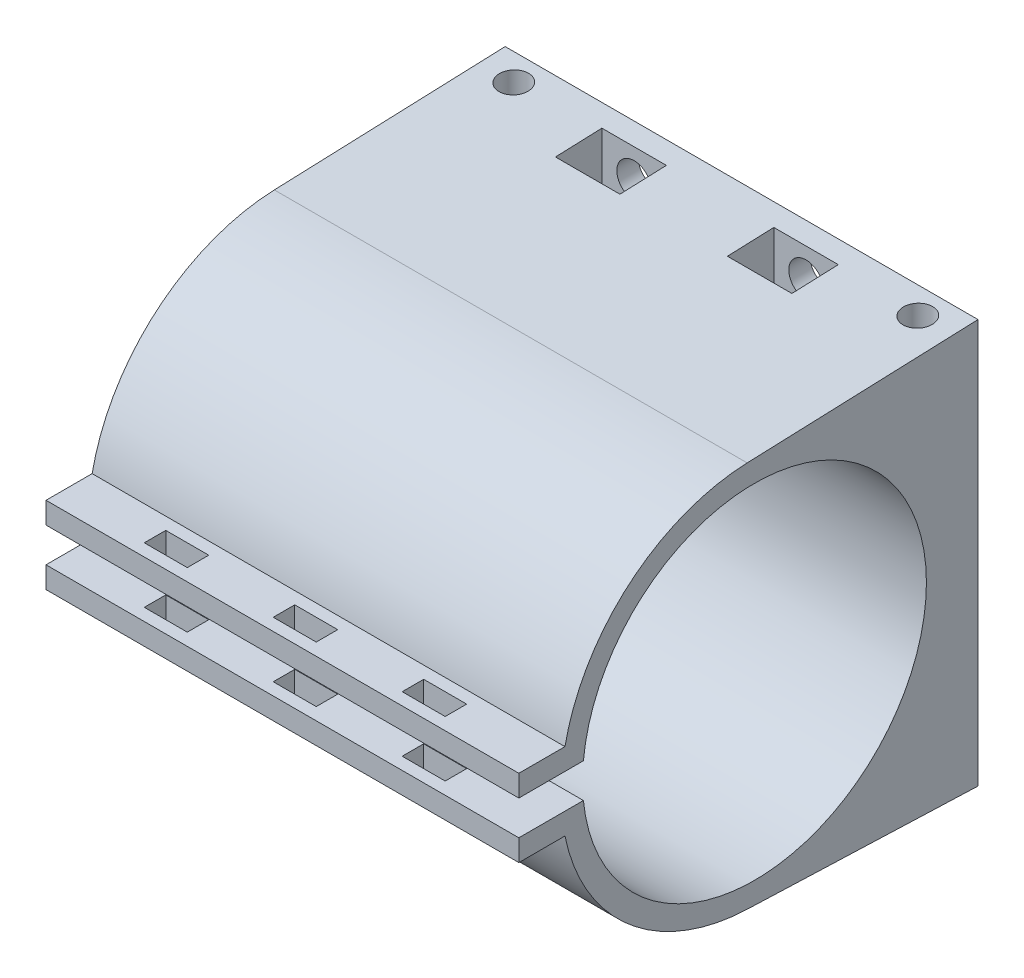
from build123d import *

# Parameters (mm, degrees)
SKETCH1_R               = 28.575
SKETCH1_R_2             = 25.4
BOSS_EXTRUDE1_DEPTH     = 69.85
BOSS_EXTRUDE2_DEPTH     = 69.85
SKETCH4_R               = 2.5527
CUT_EXTRUDE1_DEPTH      = 16.256
CUT_EXTRUDE2_DEPTH      = 6.858
SKETCH9_W               = 9.949702626
SKETCH9_H               = 5.08
CUT_EXTRUDE3_DEPTH      = 83.825520976
BOSS_EXTRUDE3_DEPTH     = 69.85
SKETCH11_W              = 6.35
SKETCH11_H              = 3.175
CUT_EXTRUDE4_DEPTH      = 86.763649601
CUT_EXTRUDE5_DEPTH      = 84.332323558
CUT_EXTRUDE5_DEPTH_BACK = 84.332323558
SKETCH13_R              = 2.1844


with BuildPart() as part:
    # Sketch1 → Boss-Extrude1 (new body)
    with BuildSketch(Plane(origin=(0, 0, 0), x_dir=(0, 0, -1), z_dir=(1, 0, 0))):
        Circle(SKETCH1_R)
        Circle(SKETCH1_R_2, mode=Mode.SUBTRACT)
    extrude(amount=BOSS_EXTRUDE1_DEPTH)

    # Sketch2 → Boss-Extrude2 (add, through all)
    with BuildSketch(Plane(origin=(69.85, 0, 0), x_dir=(0, 0, -1), z_dir=(1, 0, 0))):
        with BuildLine():
            Line((33.02, -29.845), (33.02, 29.845))
            Line((33.02, 29.845), (-1.080565529, 28.554561862))
            ThreePointArc((-1.080565529, 28.554561862), (28.575, 0), (-1.080565529, -28.554561862))
            Line((-1.080565529, -28.554561862), (33.02, -29.845))
        make_face()
    extrude(amount=-BOSS_EXTRUDE2_DEPTH)

    # Sketch4 → Cut-Extrude1 (cut)
    with BuildSketch(Plane(origin=(0, 0, -33.02), x_dir=(-1, 0, 0), z_dir=(0, 0, -1))):
        with Locations((-47.625, 25.4)):
            Circle(SKETCH4_R)
        with Locations((-22.225, 25.4)):
            Circle(SKETCH4_R)
        with Locations((-34.925, -25.4)):
            Circle(SKETCH4_R)
    extrude(amount=-CUT_EXTRUDE1_DEPTH, mode=Mode.SUBTRACT)

    # Sketch7 → Cut-Extrude2 (cut)
    with BuildSketch(Plane(origin=(0, 0, -29.845), x_dir=(-1, 0, 0), z_dir=(0, 0, -1))):
        Polygon((-47.625, 19.900738686), (-42.8625, 22.650369343), (-42.8625, 29.845), (-45.79896584, 29.845), (-49.45103416, 29.845), (-52.3875, 29.845), (-52.3875, 22.650369343), align=None)
        Polygon((-24.05103416, 29.845), (-26.9875, 29.845), (-26.9875, 22.650369343), (-22.225, 19.900738686), (-17.4625, 22.650369343), (-17.4625, 29.845), (-20.39896584, 29.845), align=None)
        Polygon((-39.6875, -22.650369343), (-39.6875, -29.845), (-36.75103416, -29.845), (-33.09896584, -29.845), (-30.1625, -29.845), (-30.1625, -22.650369343), (-34.925, -19.900738686), align=None)
    extrude(amount=-CUT_EXTRUDE2_DEPTH, mode=Mode.SUBTRACT)

    # Sketch9 → Cut-Extrude3 (cut, through all)
    with BuildSketch(Plane(origin=(69.85, 0, 0), x_dir=(0, 0, -1), z_dir=(1, 0, 0))):
        with Locations((-25.4, 0)):
            Rectangle(SKETCH9_W, SKETCH9_H)
    extrude(amount=-CUT_EXTRUDE3_DEPTH, mode=Mode.SUBTRACT)

    # Sketch10 → Boss-Extrude3 (add, through all)
    with BuildSketch(Plane(origin=(69.85, 0, 0), x_dir=(0, 0, -1), z_dir=(1, 0, 0))):
        with BuildLine():
            Line((-34.811887235, 2.54), (-28.461887235, 2.54))
            ThreePointArc((-28.461887235, 2.54), (-28.274378752, 4.134021188), (-27.99766776, 5.715))
            Line((-27.99766776, 5.715), (-34.811887235, 5.715))
            Line((-34.811887235, 5.715), (-34.811887235, 2.54))
        make_face()
        with BuildLine():
            ThreePointArc((-27.99766776, -5.715), (-28.274378752, -4.134021188), (-28.461887235, -2.54))
            Line((-28.461887235, -2.54), (-34.811887235, -2.54))
            Line((-34.811887235, -2.54), (-34.811887235, -5.715))
            Line((-34.811887235, -5.715), (-27.99766776, -5.715))
        make_face()
    extrude(amount=-BOSS_EXTRUDE3_DEPTH)

    # Sketch11 → Cut-Extrude4 (cut, through all)
    with BuildSketch(Plane(origin=(0, 5.715, 0), x_dir=(1, 0, 0), z_dir=(0, 1, 0))):
        with Locations((53.975, -31.404777498)):
            Rectangle(SKETCH11_W, SKETCH11_H)
        with Locations((34.925, -31.404777498)):
            Rectangle(SKETCH11_W, SKETCH11_H)
        with Locations((15.875, -31.404777498)):
            Rectangle(SKETCH11_W, SKETCH11_H)
    extrude(amount=-CUT_EXTRUDE4_DEPTH, mode=Mode.SUBTRACT)

    # Sketch13 → Cut-Extrude5 (cut, two sides: drawn at the far end of the back side and taken through both)
    with BuildSketch(Plane(origin=(0, 0, 0.540476051), x_dir=(1, 0, 0), z_dir=(0, -1, 0)).offset(-CUT_EXTRUDE5_DEPTH_BACK)):
        with Locations(Location((64.77, -29.750476051, 0), (0, 0, 270))):
            Circle(SKETCH13_R)
        with Locations(Location((5.08, -29.750476051, 0), (0, 0, 270))):
            Circle(SKETCH13_R)
    extrude(amount=CUT_EXTRUDE5_DEPTH + CUT_EXTRUDE5_DEPTH_BACK, mode=Mode.SUBTRACT)


solid = part.part
